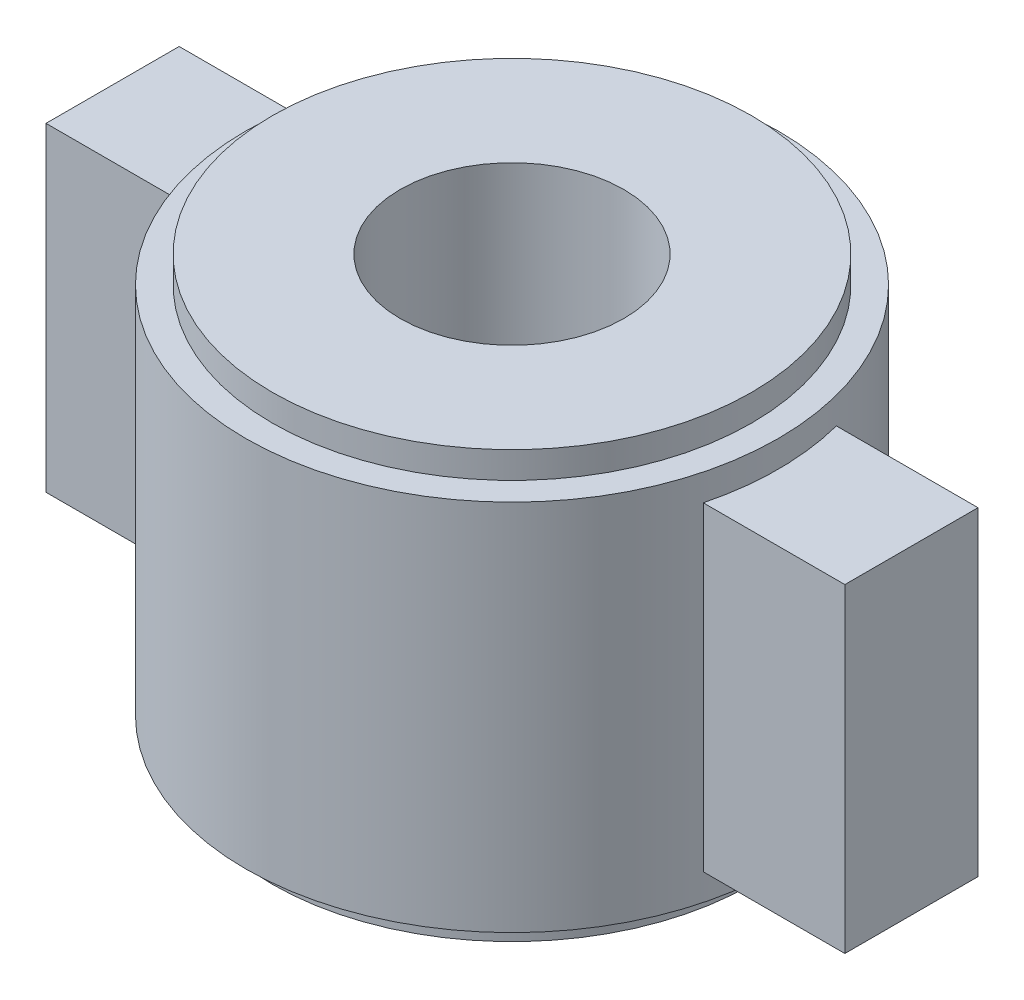
from build123d import *

# Parameters (mm, degrees)
SKETCH_3_W              = 7
SKETCH_3_H              = 12
CONTINUOUS_TONGUE_DEPTH = 5
SKETCH_4_W              = 7
SKETCH_4_H              = 12
EXTRUDE_2_DEPTH         = 5


with BuildPart() as part:
    # 草图1 → Round_nut (revolve)
    with BuildSketch(Plane.XY, mode=Mode.PRIVATE) as round_nut_sk:
        Polygon((4.2, 0), (9, 0), (9, 1), (10, 1), (10, 15), (9, 15), (9, 16), (4.2, 16), align=None)
    revolve(round_nut_sk.sketch.rotate(Axis((0, 0, 0), (0, 1, 0)), 90), axis=Axis((0, 0, 0), (0, 1, 0)))

    # 草图3 → Continuous_tongue (add)
    with BuildSketch(Plane.XY.offset(-2.5)):
        with Locations((-11.5, 8)):
            Rectangle(SKETCH_3_W, SKETCH_3_H)
    extrude(amount=CONTINUOUS_TONGUE_DEPTH)

    # 草图4 → 凸台-拉伸2 (add)
    with BuildSketch(Plane.XY.offset(-2.5)):
        with Locations((11.5, 8)):
            Rectangle(SKETCH_4_W, SKETCH_4_H)
    extrude(amount=EXTRUDE_2_DEPTH)


solid = part.part
